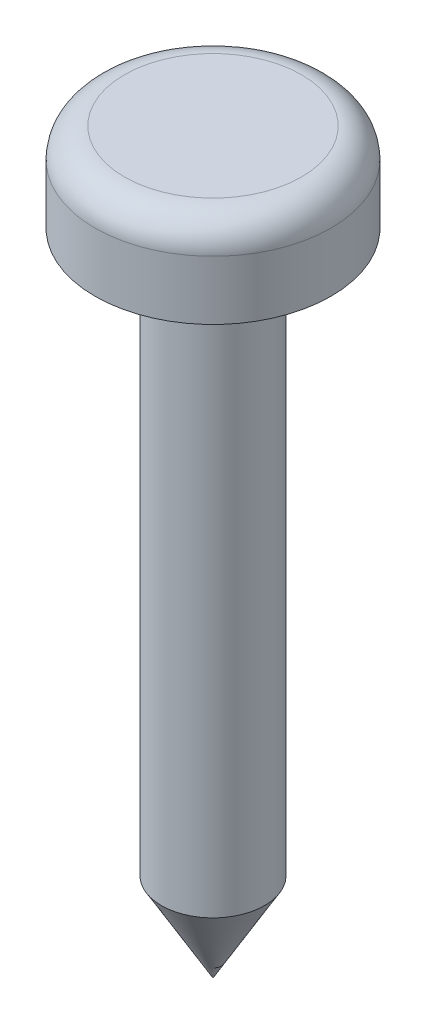
from build123d import *


with BuildPart() as part:
    # Sketch1 → Revolve2 (revolve)
    with BuildSketch(Plane.XY, mode=Mode.PRIVATE) as revolve2_sk:
        with BuildLine():
            Line((0, 0), (-1.75, 3))
            Line((-1.75, 3), (-1.75, 22))
            Line((-1.75, 22), (-4, 22))
            Line((-4, 22), (-4, 24))
            ThreePointArc((-4, 24), (-3.707106781, 24.707106781), (-3, 25))
            Line((-3, 25), (0, 25))
            Line((0, 25), (0, 0))
        make_face()
    revolve(revolve2_sk.sketch.rotate(Axis((0, 86.315756186, 0), (0, -1, 0)), 270), axis=Axis((0, 86.315756186, 0), (0, -1, 0)))


solid = part.part
